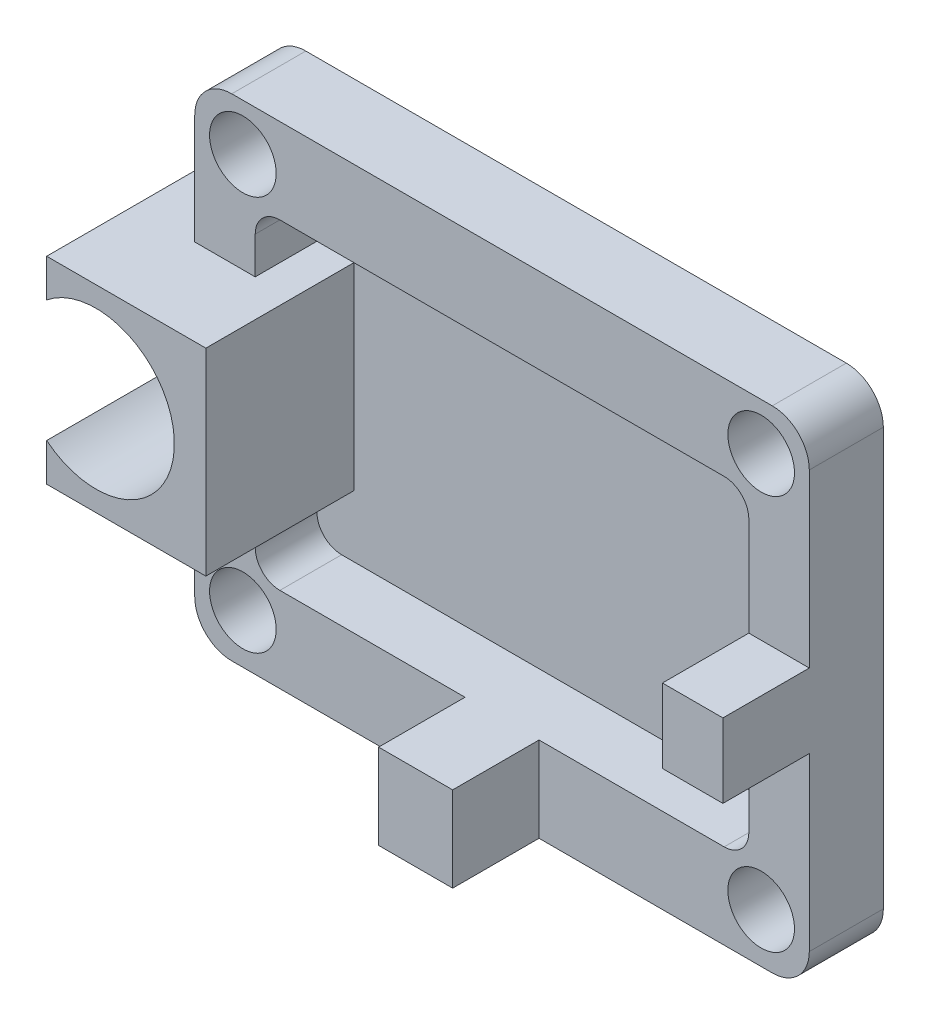
from build123d import *

# Parameters (mm, degrees)
CROQUIS1_W              = 49.8
CROQUIS1_H              = 39.8
CROQUIS1_R              = 2.7
SALIENTE_EXTRUIR1_DEPTH = 6
CORTAR_EXTRUIR1_DEPTH   = 5
CROQUIS3_W              = 4.9
CROQUIS3_H              = 6
CROQUIS3_W_2            = 6
CROQUIS3_H_2            = 6.9
SALIENTE_EXTRUIR2_DEPTH = 7
REDONDEO1_R             = 3
SALIENTE_EXTRUIR3_DEPTH = 3
CROQUIS5_R              = 6.35
CORTAR_EXTRUIR2_DEPTH   = 3
SALIENTE_EXTRUIR4_DEPTH = 10
SALIENTE_EXTRUIR5_DEPTH = 2
CORTAR_EXTRUIR3_START   = -3
CORTAR_EXTRUIR3_DEPTH   = 3


with BuildPart() as part:
    # Croquis1 → Saliente-Extruir1 (new body)
    with BuildSketch(Plane.XY):
        with Locations((-31.963412372, -3.757931034)):
            Rectangle(CROQUIS1_W, CROQUIS1_H)
        with Locations((-52.963412372, 12.342068966)):
            Circle(CROQUIS1_R, mode=Mode.SUBTRACT)
        with Locations((-10.963412372, 12.342068966)):
            Circle(CROQUIS1_R, mode=Mode.SUBTRACT)
        with Locations((-10.963412372, -19.657931034)):
            Circle(CROQUIS1_R, mode=Mode.SUBTRACT)
        with Locations((-52.963412372, -19.657931034)):
            Circle(CROQUIS1_R, mode=Mode.SUBTRACT)
    extrude(amount=SALIENTE_EXTRUIR1_DEPTH)

    # Croquis2 → Cortar-Extruir1 (cut)
    with BuildSketch(Plane.XY.offset(6)):
        with BuildLine():
            Line((-49.963412372, -16.757931034), (-13.963412372, -16.757931034))
            ThreePointArc((-13.963412372, -16.757931034), (-12.54919881, -16.172144597), (-11.963412372, -14.757931034))
            Line((-11.963412372, -14.757931034), (-11.963412372, 7.242068966))
            ThreePointArc((-11.963412372, 7.242068966), (-12.54919881, 8.656282528), (-13.963412372, 9.242068966))
            Line((-13.963412372, 9.242068966), (-49.963412372, 9.242068966))
            ThreePointArc((-49.963412372, 9.242068966), (-51.377625934, 8.656282528), (-51.963412372, 7.242068966))
            Line((-51.963412372, 7.242068966), (-51.963412372, -14.757931034))
            ThreePointArc((-51.963412372, -14.757931034), (-51.377625934, -16.172144597), (-49.963412372, -16.757931034))
        make_face()
    extrude(amount=-CORTAR_EXTRUIR1_DEPTH, mode=Mode.SUBTRACT)

    # Croquis3 → Saliente-Extruir2 (add)
    with BuildSketch(Plane.XY.offset(6)):
        with Locations((-9.513412372, -3.757931034)):
            Rectangle(CROQUIS3_W, CROQUIS3_H)
        with Locations((-31.963412372, -20.207931034)):
            Rectangle(CROQUIS3_W_2, CROQUIS3_H_2)
    extrude(amount=SALIENTE_EXTRUIR2_DEPTH)

    # Redondeo1
    redondeo1_edges = [part.edges().sort_by_distance(p)[0] for p in [
        (-56.863412372, 16.142068966, 3),
        (-7.063412372, 16.142068966, 3),
        (-7.063412372, -23.657931034, 3),
        (-56.863412372, -23.657931034, 3),
    ]]
    fillet(redondeo1_edges, radius=REDONDEO1_R)

    # Croquis4 → Saliente-Extruir3 (add)
    with BuildSketch(Plane(origin=(0, 0, 0), x_dir=(-1, 0, 0), z_dir=(0, 0, -1))):
        with BuildLine():
            Line((56.863412372, 4.242068966), (61.863412372, 4.242068966))
            Line((61.863412372, 4.242068966), (61.863412372, -0.257931034))
            Line((61.863412372, -0.257931034), (57.863412372, -0.257931034))
            ThreePointArc((57.863412372, -0.257931034), (57.358118834, -0.294597605), (56.863412372, -0.403829068))
            Line((56.863412372, -0.403829068), (56.863412372, 4.242068966))
        make_face()
        with BuildLine():
            Line((61.863412372, -11.757931034), (56.863412372, -11.757931034))
            Line((56.863412372, -11.757931034), (56.863412372, -7.112033001))
            ThreePointArc((56.863412372, -7.112033001), (57.358118834, -7.221264464), (57.863412372, -7.257931034))
            Line((57.863412372, -7.257931034), (61.863412372, -7.257931034))
            Line((61.863412372, -7.257931034), (61.863412372, -11.757931034))
        make_face()
    extrude(amount=-SALIENTE_EXTRUIR3_DEPTH)

    # Croquis5 → Cortar-Extruir2 (cut)
    with BuildSketch(Plane.XY.offset(3)):
        with Locations((-57.863412372, -3.757931034)):
            Circle(CROQUIS5_R)
    extrude(amount=CORTAR_EXTRUIR2_DEPTH, mode=Mode.SUBTRACT)

    # Croquis6 → Saliente-Extruir4 (add)
    with BuildSketch(Plane.XY.offset(3)):
        with BuildLine():
            Line((-61.863412372, 4.242068966), (-51.963412372, 4.242068966))
            Line((-51.963412372, 4.242068966), (-48.963412372, 4.242068966))
            Line((-48.963412372, 4.242068966), (-48.963412372, -11.757931034))
            Line((-48.963412372, -11.757931034), (-51.963412372, -11.757931034))
            Line((-51.963412372, -11.757931034), (-61.863412372, -11.757931034))
            Line((-61.863412372, -11.757931034), (-61.863412372, -8.689715701))
            ThreePointArc((-61.863412372, -8.689715701), (-51.513412372, -3.757931034), (-61.863412372, 1.173853632))
            Line((-61.863412372, 1.173853632), (-61.863412372, 4.242068966))
        make_face()
    extrude(amount=SALIENTE_EXTRUIR4_DEPTH)

    # Croquis7 → Saliente-Extruir5 (add)
    with BuildSketch(Plane.XY.offset(1)):
        Polygon((-51.963412372, -3.757931034), (-51.963412372, 4.242068966), (-48.963412372, 4.242068966), (-48.963412372, -11.757931034), (-51.963412372, -11.757931034), align=None)
    extrude(amount=SALIENTE_EXTRUIR5_DEPTH)

    # Croquis8 → Cortar-Extruir3 (cut)
    with BuildSketch(Plane.XY.offset(3).offset(CORTAR_EXTRUIR3_START)):
        with BuildLine():
            Line((-56.863412372, -0.403829068), (-56.863412372, -7.112033001))
            ThreePointArc((-56.863412372, -7.112033001), (-53.509310406, -3.757931034), (-56.863412372, -0.403829068))
        make_face()
    extrude(amount=CORTAR_EXTRUIR3_DEPTH, mode=Mode.SUBTRACT)


solid = part.part
